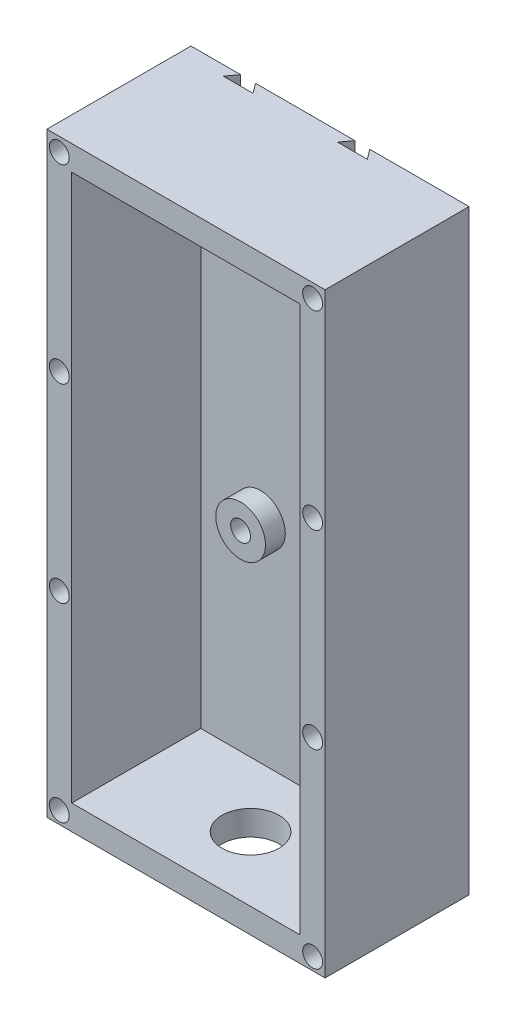
from build123d import *

# Parameters (mm, degrees)
SKICA1_W                      = 56
SKICA1_H                      = 120
P_IDAT_VYSUNUT_M1_DEPTH       = 3
SKICA2_W                      = 56
SKICA2_H                      = 120
SKICA2_W_2                    = 46
SKICA2_H_2                    = 110
P_IDAT_VYSUNUT_M2_DEPTH       = 26
SKICA3_R                      = 5.75
ODEBRAT_VYSUNUT_M1_DEPTH      = 5
SKICA4_R                      = 5
SKICA4_R_2                    = 2
P_IDAT_VYSUNUT_M3_DEPTH       = 4
SKICA5_R                      = 2
ODEBRAT_VYSUNUT_M2_DEPTH      = 4
ODEBRAT_VYSUNUT_M3_DEPTH      = 169.038686022
ODEBRAT_VYSUNUT_M3_DEPTH_BACK = 169.038686022


with BuildPart() as part:
    # Skica1 → Přidat vysunutím1 (new body)
    with BuildSketch(Plane.XY):
        with Locations((-86, 47)):
            Rectangle(SKICA1_W, SKICA1_H)
    extrude(amount=P_IDAT_VYSUNUT_M1_DEPTH)



with BuildPart() as body_2:
    # Skica2 → Přidat vysunutím2 (new body)
    with BuildSketch(Plane.XY.offset(3)):
        with Locations((-86, 47)):
            Rectangle(SKICA2_W, SKICA2_H)
        with Locations((-86, 47)):
            Rectangle(SKICA2_W_2, SKICA2_H_2, mode=Mode.SUBTRACT)
    extrude(amount=P_IDAT_VYSUNUT_M2_DEPTH)

    # Skica3 → Odebrat vysunutím1 (cut)
    with BuildSketch(Plane.XZ.offset(13)):
        with Locations(Location((-86, 16, 0), (0, 0, 270))):
            Circle(SKICA3_R)
    extrude(amount=-ODEBRAT_VYSUNUT_M1_DEPTH, mode=Mode.SUBTRACT)


with BuildPart() as part_1:
    add(part.part)

    add(body_2.part)  # Přidat vysunutím3 merges body 2
    # Skica4 → Přidat vysunutím3 (add)
    # profile 1 of 4: a face of its own
    with BuildSketch(Plane.XY.offset(3)):
        with Locations((-97, 87.5)):
            Circle(SKICA4_R)
        with Locations((-97, 87.5)):
            Circle(SKICA4_R_2, mode=Mode.SUBTRACT)
    # profile 2 of 4: a face of its own
    with BuildSketch(Plane.XY.offset(3)):
        with Locations((-97, 34.5)):
            Circle(SKICA4_R)
        with Locations((-97, 34.5)):
            Circle(SKICA4_R_2, mode=Mode.SUBTRACT)
    # profile 3 of 4: a face of its own
    with BuildSketch(Plane.XY.offset(3)):
        with Locations(Location((-75, 34.5, 0), (0, 0, 180))):
            Circle(SKICA4_R)
        with Locations(Location((-75, 34.5, 0), (0, 0, 180))):
            Circle(SKICA4_R_2, mode=Mode.SUBTRACT)
    # profile 4 of 4: a face of its own
    with BuildSketch(Plane.XY.offset(3)):
        with Locations(Location((-75, 87.5, 0), (0, 0, 180))):
            Circle(SKICA4_R)
        with Locations(Location((-75, 87.5, 0), (0, 0, 180))):
            Circle(SKICA4_R_2, mode=Mode.SUBTRACT)
    extrude(amount=P_IDAT_VYSUNUT_M3_DEPTH)

    # Skica5 → Odebrat vysunutím2 (cut)
    with BuildSketch(Plane.XY.offset(29)):
        with Locations((-111.5, -10.5)):
            Circle(SKICA5_R)
        with Locations((-60.5, -10.5)):
            Circle(SKICA5_R)
        with Locations((-60.5, 27.75)):
            Circle(SKICA5_R)
        with Locations((-60.5, 66)):
            Circle(SKICA5_R)
        with Locations((-60.5, 104.25)):
            Circle(SKICA5_R)
        with Locations((-111.5, 27.75)):
            Circle(SKICA5_R)
        with Locations((-111.5, 66)):
            Circle(SKICA5_R)
        with Locations((-111.5, 104.25)):
            Circle(SKICA5_R)
    extrude(amount=-ODEBRAT_VYSUNUT_M2_DEPTH, mode=Mode.SUBTRACT)

    # Skica6 → Odebrat vysunutím3 (cut, two sides: drawn at the far end of the back side and taken through both)
    with BuildSketch(Plane(origin=(0, 107, 0), x_dir=(1, 0, 0), z_dir=(0, 1, 0)).offset(-ODEBRAT_VYSUNUT_M3_DEPTH_BACK)):
        Polygon((-104, 0), (-105.5, -2), (-99.5, -2), (-101, 0), align=None)
        Polygon((-81, 0), (-82.5, -2), (-76.5, -2), (-78, 0), align=None)
    extrude(amount=ODEBRAT_VYSUNUT_M3_DEPTH + ODEBRAT_VYSUNUT_M3_DEPTH_BACK, mode=Mode.SUBTRACT)


solid = part_1.part
